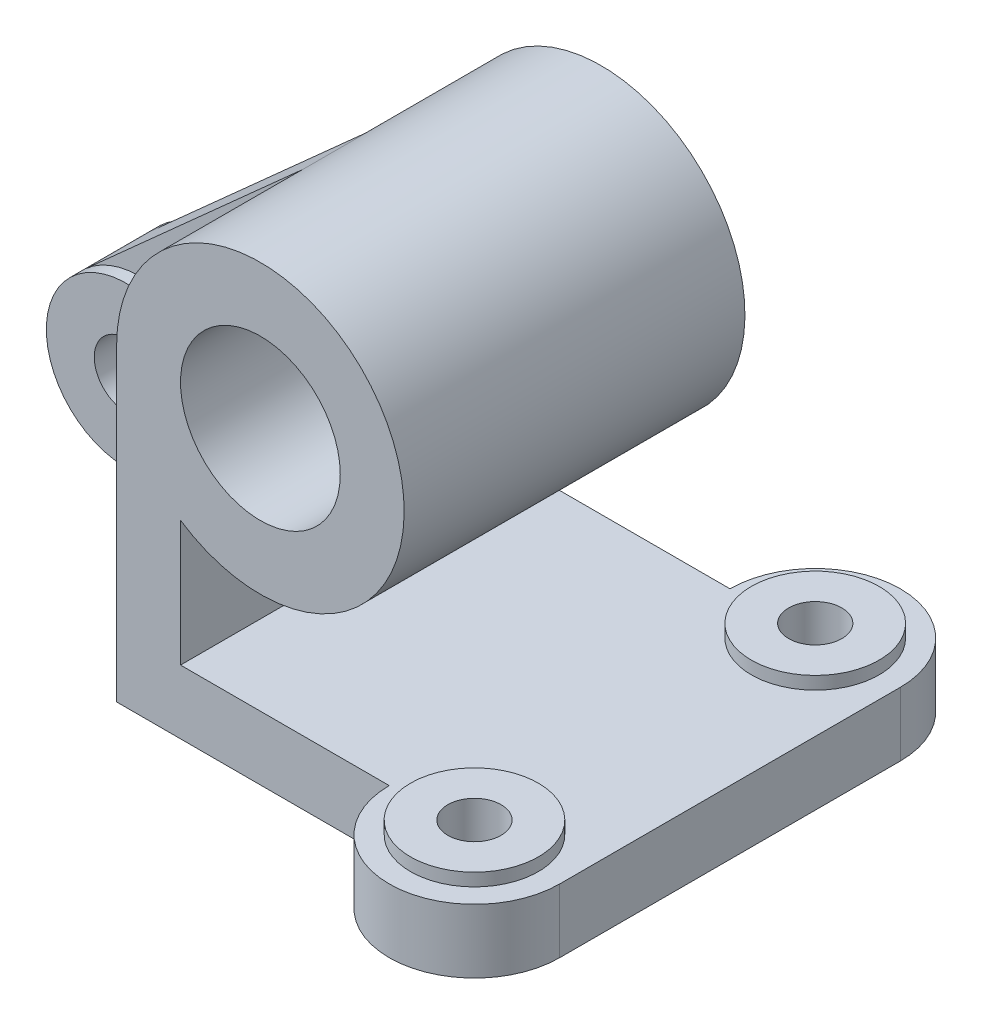
from build123d import *
from build123d.topology import SkipClean

# Parameters (mm, degrees)
SKETCH1_R            = 67.5
SKETCH1_R_2          = 37.5
SKETCH1_W            = 80
SKETCH1_H            = 30
BOSS_EXTRUDE3_DEPTH  = 80
BOSS_EXTRUDE4_DEPTH  = 15
SKETCH1_6_R          = 37.5
SKETCH1_6_R_2        = 15
BOSS_EXTRUDE5_DEPTH  = 21
BOSS_EXTRUDE13_START = -30
BOSS_EXTRUDE13_DEPTH = 30
BOSS_EXTRUDE14_START = -30
BOSS_EXTRUDE14_DEPTH = 36
SKETCH3_11_R         = 12.5
CUT_EXTRUDE3_DEPTH   = 271.45518904


with BuildPart() as part:
    # Sketch1 → Boss-Extrude3 (new, symmetric)
    # profile 1 of 3: a face of its own
    with BuildSketch(Plane.XY):
        with BuildLine():
            ThreePointArc((-37.5, -56.124860802), (-59.529404499, -31.819805153), (-67.5, 0))
            Line((-67.5, 0), (-67.5, -144.998655553))
            Line((-67.5, -144.998655553), (20.5, -144.998655553))
            Line((20.5, -144.998655553), (20.5, -114.998655553))
            Line((20.5, -114.998655553), (-37.5, -114.998655553))
            Line((-37.5, -114.998655553), (-37.5, -56.124860802))
        make_face()
    # profile 2 of 3: a face of its own
    with BuildSketch(Plane.XY):
        Circle(SKETCH1_R)
        Circle(SKETCH1_R_2, mode=Mode.SUBTRACT)
    # profile 3 of 3: a face of its own
    with BuildSketch(Plane.XY):
        with Locations((60.5, -129.998655553)):
            Rectangle(SKETCH1_W, SKETCH1_H)
    extrude(amount=BOSS_EXTRUDE3_DEPTH, both=True)

    # Sketch1<5> → Boss-Extrude4 (add, symmetric)
    with BuildSketch(Plane.XY):
        with BuildLine():
            Line((-67.5, -144.998655553), (-67.5, 0))
            ThreePointArc((-67.5, 0), (-61.628366728, 27.535330295), (-45.034980312, 50.280220249))
            Line((-45.034980312, 50.280220249), (-147.019433507, -41.065199859))
            ThreePointArc((-147.019433507, -41.065199859), (-106.70259428, -34.760674037), (-84.5, -68.998655553))
            ThreePointArc((-84.5, -68.998655553), (-103.453333037, -101.591156907), (-141.154461042, -101.237709853))
            Line((-141.154461042, -101.237709853), (-67.5, -144.998655553))
        make_face()
    extrude(amount=BOSS_EXTRUDE4_DEPTH, both=True)

    # Sketch1<6> → Boss-Extrude5 (add, symmetric)
    with BuildSketch(Plane.XY):
        with Locations((-122, -68.998655553)):
            Circle(SKETCH1_6_R)
        with Locations(Location((-122, -68.998655553, 0), (0, 0, 180))):
            Circle(SKETCH1_6_R_2, mode=Mode.SUBTRACT)
    extrude(amount=BOSS_EXTRUDE5_DEPTH, both=True)

    # Sketch3 → Boss-Extrude13 (add)
    with BuildSketch(Plane(origin=(0, -114.998655553, 0), x_dir=(1, 0, 0), z_dir=(0, 1, 0)).offset(BOSS_EXTRUDE13_START)):
        with BuildLine():
            Line((100.5, 40), (100.5, 0))
            Line((100.5, 0), (140.5, 0))
            Line((140.5, 0), (140.5, 80))
            Line((140.5, 80), (130.5, 80))
            ThreePointArc((130.5, 80), (121.713203436, 58.786796564), (100.5, 50))
            Line((100.5, 50), (100.5, 40))
        make_face()
        with BuildLine():
            Line((140.5, 0), (100.5, 0))
            Line((100.5, 0), (100.5, -40))
            Line((100.5, -40), (100.5, -50))
            ThreePointArc((100.5, -50), (121.713203436, -58.786796564), (130.5, -80))
            ThreePointArc((130.5, -80), (100.5, -110), (70.5, -80))
            Line((70.5, -80), (60.5, -80))
            ThreePointArc((60.5, -80), (100.5, -120), (140.5, -80))
            Line((140.5, -80), (140.5, 0))
        make_face()
        with BuildLine():
            Line((130.5, 80), (140.5, 80))
            ThreePointArc((140.5, 80), (100.5, 120), (60.5, 80))
            Line((60.5, 80), (70.5, 80))
            ThreePointArc((70.5, 80), (100.5, 110), (130.5, 80))
        make_face()
    extrude(amount=BOSS_EXTRUDE13_DEPTH)

    # Sketch3<10> → Boss-Extrude14 (add)
    with BuildSketch(Plane(origin=(0, -114.998655553, 0), x_dir=(1, 0, 0), z_dir=(0, 1, 0)).offset(BOSS_EXTRUDE14_START)):
        with BuildLine():
            Line((88, -80), (70.5, -80))
            ThreePointArc((70.5, -80), (100.5, -110), (130.5, -80))
            ThreePointArc((130.5, -80), (121.713203436, -58.786796564), (100.5, -50))
            Line((100.5, -50), (100.5, -67.5))
            ThreePointArc((100.5, -67.5), (109.338834765, -71.161165235), (113, -80))
            ThreePointArc((113, -80), (100.5, -92.5), (88, -80))
        make_face()
        with BuildLine():
            ThreePointArc((100.5, -50), (79.286796564, -58.786796564), (70.5, -80))
            Line((70.5, -80), (88, -80))
            ThreePointArc((88, -80), (91.661165235, -71.161165235), (100.5, -67.5))
            Line((100.5, -67.5), (100.5, -50))
        make_face()
        with BuildLine():
            Line((113, 80), (130.5, 80))
            ThreePointArc((130.5, 80), (100.5, 110), (70.5, 80))
            Line((70.5, 80), (88, 80))
            ThreePointArc((88, 80), (100.5, 92.5), (113, 80))
        make_face()
        with BuildLine():
            ThreePointArc((100.5, 50), (121.713203436, 58.786796564), (130.5, 80))
            Line((130.5, 80), (113, 80))
            ThreePointArc((113, 80), (109.338834765, 71.161165235), (100.5, 67.5))
            Line((100.5, 67.5), (100.5, 50))
        make_face()
        with BuildLine():
            Line((88, 80), (70.5, 80))
            ThreePointArc((70.5, 80), (79.286796564, 58.786796564), (100.5, 50))
            Line((100.5, 50), (100.5, 67.5))
            ThreePointArc((100.5, 67.5), (91.661165235, 71.161165235), (88, 80))
        make_face()
    extrude(amount=BOSS_EXTRUDE14_DEPTH)

    # Sketch3<11> → Cut-Extrude3 (cut, through all)
    with SkipClean():  # the faces are left unmerged after this step: merging them gives an invalid solid
        with BuildSketch(Plane(origin=(0, -114.998655553, 0), x_dir=(1, 0, 0), z_dir=(0, 1, 0))):
            with Locations(Location((100.5, -80, 0), (0, 0, 180))):
                Circle(SKETCH3_11_R)
            with Locations(Location((100.5, 80, 0), (0, 0, 180))):
                Circle(SKETCH3_11_R)
        extrude(amount=-CUT_EXTRUDE3_DEPTH, mode=Mode.SUBTRACT)


solid = part.part
